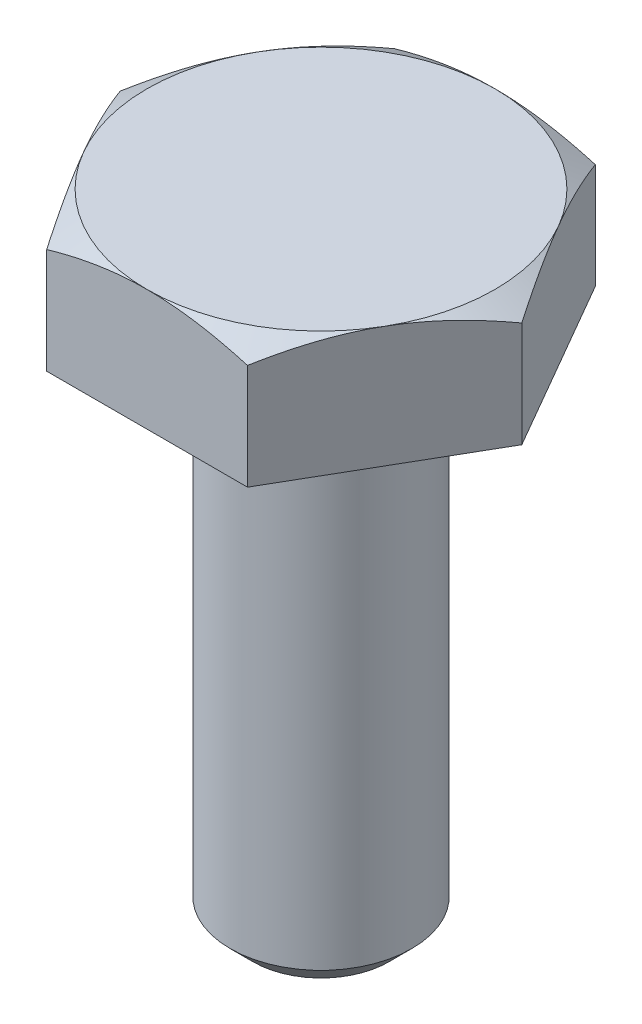
from build123d import *

# Parameters (mm, degrees)
BOSS_EXTRUDE2_DEPTH = 4
SKETCH1_7_R         = 3
BOSS_EXTRUDE3_DEPTH = 21
CHAMFER2_SIZE       = 0.75
SKETCH3_OUTSIDE_W   = 93.502
SKETCH3_OUTSIDE_H   = 91.722
SKETCH3_OUTSIDE_R   = 5.75
CUT_EXTRUDE1_DEPTH  = 21
CUT_EXTRUDE1_DRAFT  = -60


with BuildPart() as part:
    # Sketch1 → Boss-Extrude2 (new body)
    with BuildSketch(Plane(origin=(0, 0, 0), x_dir=(1, 0, 0), z_dir=(0, 1, 0))):
        Polygon((3.319764048, -5.75), (6.639528096, 0), (3.319764048, 5.75), (-3.319764048, 5.75), (-6.639528096, 0), (-3.319764048, -5.75), align=None)
    extrude(amount=-BOSS_EXTRUDE2_DEPTH)

    # Sketch1<7> → Boss-Extrude3 (add)
    with BuildSketch(Plane(origin=(0, 0, 0), x_dir=(1, 0, 0), z_dir=(0, 1, 0))):
        Circle(SKETCH1_7_R)
    extrude(amount=-BOSS_EXTRUDE3_DEPTH)

    # Chamfer2
    chamfer2_edges = [part.edges().sort_by_distance(p)[0] for p in [
        (-3, -21, 0),
    ]]
    chamfer(chamfer2_edges, length=CHAMFER2_SIZE)


with BuildPart() as cut_extrude1_tool:
    # Sketch3 outside → Cut-Extrude1 (with draft: the straight prism first)
    with BuildSketch(Plane(origin=(0, 0, 0), x_dir=(1, 0, 0), z_dir=(0, 1, 0))):
        Rectangle(SKETCH3_OUTSIDE_W, SKETCH3_OUTSIDE_H)
        Circle(SKETCH3_OUTSIDE_R, mode=Mode.SUBTRACT)
    extrude(amount=-CUT_EXTRUDE1_DEPTH)
    # Cut-Extrude1: the draft: its side faces are tilted about the plane it starts from
    cut_extrude1_sides = [cut_extrude1_tool.faces().sort_by_distance(p)[0] for p in [
        (0, -10.5, 45.861),
        (46.751, -10.5, 0),
        (0, -10.5, -45.861),
        (-46.751, -10.5, 0),
        (-5.75, -10.5, 0),
    ]]
    draft(cut_extrude1_sides, Plane(origin=(0, 0, 0), x_dir=(1, 0, 0), z_dir=(0, 1, 0)), CUT_EXTRUDE1_DRAFT)


with BuildPart() as part_1:
    add(part.part)

    # Cut-Extrude1: cut by cut_extrude1_tool
    add(cut_extrude1_tool.part, mode=Mode.SUBTRACT)


solid = part_1.part
